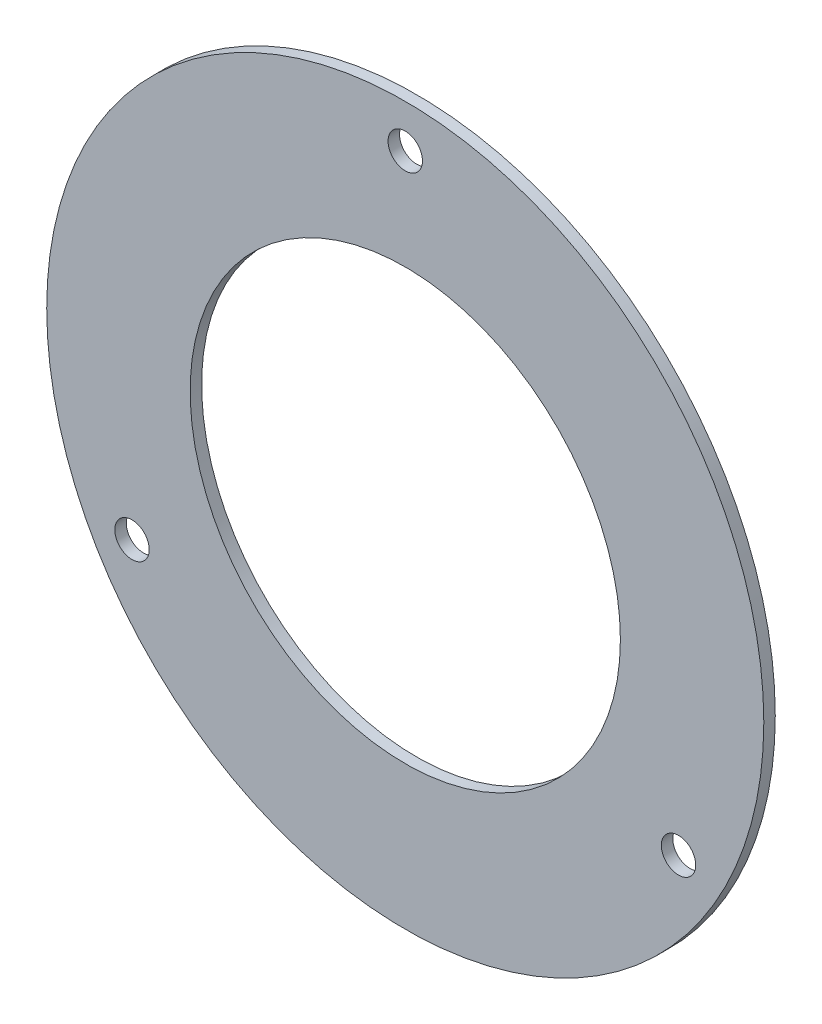
from build123d import *

# Parameters (mm, degrees)
SKETCH1_R           = 62.5
SKETCH1_R_2         = 37.5
BOSS_EXTRUDE1_DEPTH = 2
SKETCH2_R           = 3
CUT_EXTRUDE1_DEPTH  = 89.41097217
CIRPATTERN1_COUNT   = 3


with BuildPart() as part:
    # Sketch1 → Boss-Extrude1 (new body)
    with BuildSketch(Plane.XY):
        Circle(SKETCH1_R)
        Circle(SKETCH1_R_2, mode=Mode.SUBTRACT)
    extrude(amount=BOSS_EXTRUDE1_DEPTH)

    # Sketch2 → Cut-Extrude1 (cut, through all)
    with BuildSketch(Plane(origin=(0, 0, 0), x_dir=(-1, 0, 0), z_dir=(0, 0, -1))):
        with Locations((0, 55)):
            Circle(SKETCH2_R)
    cut_extrude1 = extrude(amount=-CUT_EXTRUDE1_DEPTH, mode=Mode.SUBTRACT)

    # CirPattern1: Cut-Extrude1 ×3 about axis
    cirpattern1_axis = Axis((0, 0, 0), (0, 0, 1))
    for i in range(1, CIRPATTERN1_COUNT):
        add(cut_extrude1.rotate(cirpattern1_axis, i * 360 / CIRPATTERN1_COUNT), mode=Mode.SUBTRACT)


solid = part.part
